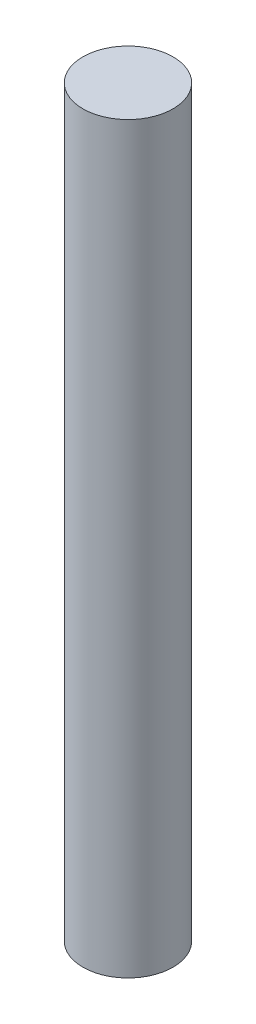
from build123d import *

# Parameters (mm, degrees)
SKETCH1_R           = 4.85
BOSS_EXTRUDE1_DEPTH = 80


with BuildPart() as part:
    # Sketch1 → Boss-Extrude1 (new body)
    with BuildSketch(Plane(origin=(0, 0, 0), x_dir=(1, 0, 0), z_dir=(0, 1, 0))):
        with Locations(Location((0, 0, 0), (0, 0, 270))):
            Circle(SKETCH1_R)
    extrude(amount=BOSS_EXTRUDE1_DEPTH)


solid = part.part
